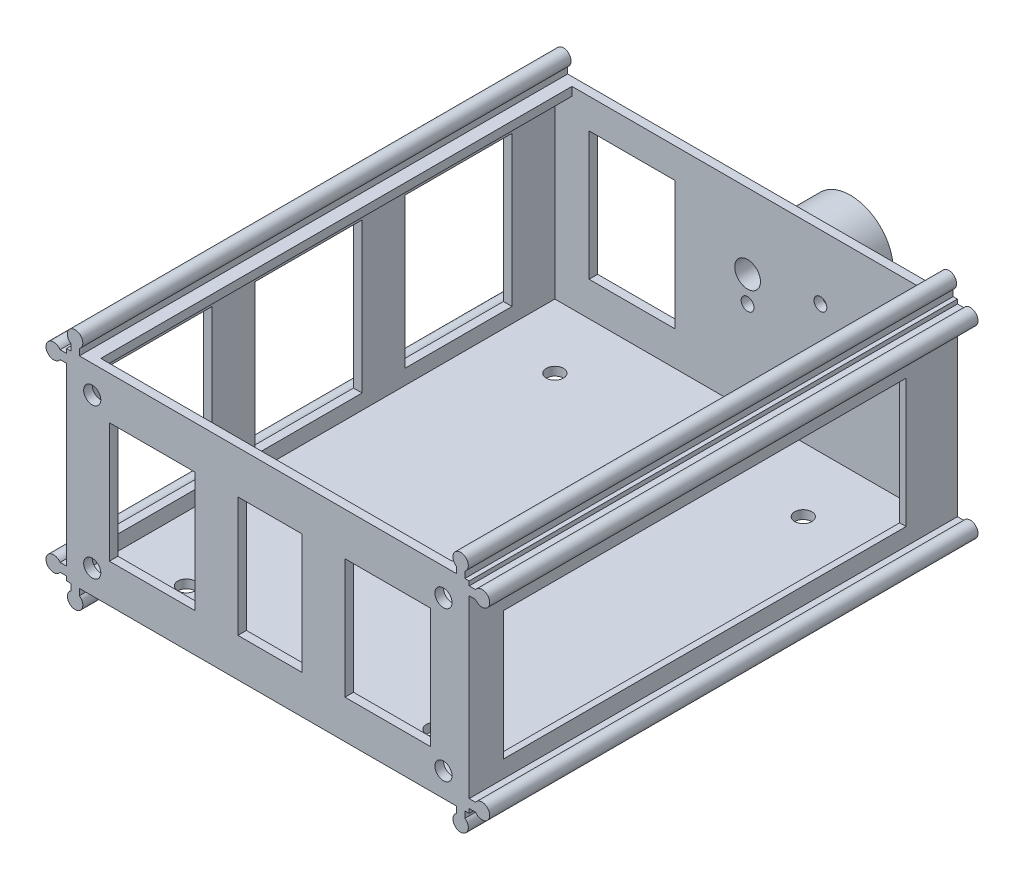
from build123d import *

# Parameters (mm, degrees)
SKETCH_1_W               = 100
SKETCH_1_H               = 130
SKETCH_1_R               = 2
EXTRUDE_1_DEPTH          = 2
SKETCH_3_W               = 100
SKETCH_3_H               = 2
EXTRUDE_2_DEPTH          = 45
SKETCH_4_W               = 1.5
SKETCH_4_H               = 110
EXTRUDE_3_DEPTH          = 5
SKETCH_5_W               = 114
SKETCH_5_H               = 47
EXTRUDE_7_DEPTH          = 2
CUT_EXTRUDE_3_DEPTH      = 171.073513517
CUT_EXTRUDE_3_DEPTH_BACK = 171.073513517
EXTRUDE_10_DEPTH         = 1.5
EXTRUDE_11_DEPTH         = 114
CUT_EXTRUDE_4_REACH      = 160.267
SKETCH_13_R              = 2
SKETCH_14_R              = 10
EXTRUDE_12_DEPTH         = 22
CUT_EXTRUDE_5_REACH      = 160.267
SKETCH_15_R              = 1.5
CUT_EXTRUDE_6_REACH      = 176.781
SKETCH_16_R              = 1.5
CUT_EXTRUDE_7_REACH      = 184.153
SKETCH_17_W              = 25
SKETCH_17_H              = 35
CUT_EXTRUDE_8_REACH      = 160.267
SKETCH_18_W              = 20
SKETCH_18_H              = 30
CUT_EXTRUDE_9_REACH      = 176.781
SKETCH_19_W              = 20
SKETCH_19_H              = 28
SKETCH_19_W_2            = 15
CUT_EXTRUDE_10_REACH     = 176.781
SKETCH_20_R              = 3


with BuildPart() as part:
    # 草图1 → 凸台-拉伸1 (new body)
    with BuildSketch(Plane(origin=(0, 0, 0), x_dir=(1, 0, 0), z_dir=(0, 1, 0))):
        with Locations((50, 65)):
            Rectangle(SKETCH_1_W, SKETCH_1_H)
        with Locations(Location((15, 105, 0), (0, 0, 270))):
            Circle(SKETCH_1_R, mode=Mode.SUBTRACT)
        with Locations(Location((15, 19, 0), (0, 0, 270))):
            Circle(SKETCH_1_R, mode=Mode.SUBTRACT)
        with Locations(Location((73, 105, 0), (0, 0, 270))):
            Circle(SKETCH_1_R, mode=Mode.SUBTRACT)
        with Locations(Location((73, 19, 0), (0, 0, 270))):
            Circle(SKETCH_1_R, mode=Mode.SUBTRACT)
    extrude(amount=EXTRUDE_1_DEPTH)

    # 草图3 → 凸台-拉伸2 (add)
    with BuildSketch(Plane(origin=(0, 2, 0), x_dir=(1, 0, 0), z_dir=(0, 1, 0))):
        with Locations((50, 121)):
            Rectangle(SKETCH_3_W, SKETCH_3_H)
        with Locations((50, 9)):
            Rectangle(SKETCH_3_W, SKETCH_3_H)
    extrude(amount=EXTRUDE_2_DEPTH)

    # 草图4 → 凸台-拉伸3 (add)
    with BuildSketch(Plane(origin=(0, 2, 0), x_dir=(1, 0, 0), z_dir=(0, 1, 0))):
        with Locations((91.25, 65)):
            Rectangle(SKETCH_4_W, SKETCH_4_H)
    extrude(amount=EXTRUDE_3_DEPTH)

    # 草图5 → 凸台-拉伸7 (add)
    with BuildSketch(Plane.ZY):
        with Locations((-65, 23.5)):
            Rectangle(SKETCH_5_W, SKETCH_5_H)
    extrude(amount=EXTRUDE_7_DEPTH)

    # 草图6 → 切除-拉伸3 (cut, two sides: drawn at the far end of the back side and taken through both)
    with BuildSketch(Plane(origin=(0, 2, 0), x_dir=(1, 0, 0), z_dir=(0, 1, 0)).offset(-CUT_EXTRUDE_3_DEPTH_BACK)):
        Polygon((0, 8), (92, 8), (92, 122), (0, 122), (0, 130), (100, 130), (100, 117), (100, 13), (100, 0), (0, 0), align=None)
    extrude(amount=CUT_EXTRUDE_3_DEPTH + CUT_EXTRUDE_3_DEPTH_BACK, mode=Mode.SUBTRACT)

    # 草图11 → 凸台-拉伸10 (add)
    with BuildSketch(Plane(origin=(92, 0, 0), x_dir=(0, 0, -1), z_dir=(1, 0, 0))):
        Polygon((8, 47), (122, 47), (122, 42), (122, 0), (110, 0), (110, 37), (16, 37), (16, 0), (8, 0), align=None)
    extrude(amount=-EXTRUDE_10_DEPTH)

    # 草图12 → 凸台-拉伸11 (add, through all)
    with BuildSketch(Plane.XY.offset(-8)):
        with BuildLine():
            Line((91, 47), (91, 48.5))
            ThreePointArc((91, 48.5), (90, 51.796662955), (89, 48.5))
            Line((89, 48.5), (89, 47))
            Line((89, 47), (86, 47))
            Line((86, 47), (86, 45))
            Line((86, 45), (90, 45))
            Line((90, 45), (90, 42.318790087))
            Line((90, 42.318790087), (92, 42.318790087))
            Line((92, 42.318790087), (92, 44))
            Line((92, 44), (93.5, 44))
            ThreePointArc((93.5, 44), (96.796662955, 45), (93.5, 46))
            Line((93.5, 46), (92, 46))
            Line((92, 46), (92, 47))
            Line((92, 47), (91, 47))
        make_face()
        with BuildLine():
            Line((0, 42.318790087), (0, 45))
            Line((0, 45), (4, 45))
            Line((4, 45), (4, 47))
            Line((4, 47), (1, 47))
            Line((1, 47), (1, 48.5))
            ThreePointArc((1, 48.5), (0, 51.796662955), (-1, 48.5))
            Line((-1, 48.5), (-1, 47))
            Line((-1, 47), (-2, 47))
            Line((-2, 47), (-2, 46))
            Line((-2, 46), (-3.5, 46))
            ThreePointArc((-3.5, 46), (-6.796662955, 45), (-3.5, 44))
            Line((-3.5, 44), (-2, 44))
            Line((-2, 44), (-2, 42.318790087))
            Line((-2, 42.318790087), (0, 42.318790087))
        make_face()
        with BuildLine():
            Line((-1, 0), (-1, -1.5))
            ThreePointArc((-1, -1.5), (0, -4.796662955), (1, -1.5))
            Line((1, -1.5), (1, 0))
            Line((1, 0), (4, 0))
            Line((4, 0), (4, 2))
            Line((4, 2), (0, 2))
            Line((0, 2), (0, 4.681209913))
            Line((0, 4.681209913), (-2, 4.681209913))
            Line((-2, 4.681209913), (-2, 3))
            Line((-2, 3), (-3.5, 3))
            ThreePointArc((-3.5, 3), (-6.796662955, 2), (-3.5, 1))
            Line((-3.5, 1), (-2, 1))
            Line((-2, 1), (-2, 0))
            Line((-2, 0), (-1, 0))
        make_face()
        with BuildLine():
            Line((90, 4.681209913), (90, 2))
            Line((90, 2), (86, 2))
            Line((86, 2), (86, 0))
            Line((86, 0), (89, 0))
            Line((89, 0), (89, -1.5))
            ThreePointArc((89, -1.5), (90, -4.796662955), (91, -1.5))
            Line((91, -1.5), (91, 0))
            Line((91, 0), (92, 0))
            Line((92, 0), (92, 1))
            Line((92, 1), (93.5, 1))
            ThreePointArc((93.5, 1), (96.796662955, 2), (93.5, 3))
            Line((93.5, 3), (92, 3))
            Line((92, 3), (92, 4.681209913))
            Line((92, 4.681209913), (90, 4.681209913))
        make_face()
    extrude(amount=-EXTRUDE_11_DEPTH)

    # 草图13 → 切除-拉伸4 (cut, up to next)
    with BuildSketch(Plane.XY.offset(-8), mode=Mode.PRIVATE) as cut_extrude_4_sk1:
        with Locations((86, 40.599475321)):
            Circle(SKETCH_13_R)
    cut_extrude_4_tool1 = extrude(cut_extrude_4_sk1.sketch, amount=-CUT_EXTRUDE_4_REACH, mode=Mode.PRIVATE) & part.part
    # 草图13 → 切除-拉伸4 (cut, up to next)
    with BuildSketch(Plane.XY.offset(-8), mode=Mode.PRIVATE) as cut_extrude_4_sk2:
        with Locations((86, 5.599475321)):
            Circle(SKETCH_13_R)
    cut_extrude_4_tool2 = extrude(cut_extrude_4_sk2.sketch, amount=-CUT_EXTRUDE_4_REACH, mode=Mode.PRIVATE) & part.part
    # 草图13 → 切除-拉伸4 (cut, up to next)
    with BuildSketch(Plane.XY.offset(-8), mode=Mode.PRIVATE) as cut_extrude_4_sk3:
        with Locations((4, 5.599475321)):
            Circle(SKETCH_13_R)
    cut_extrude_4_tool3 = extrude(cut_extrude_4_sk3.sketch, amount=-CUT_EXTRUDE_4_REACH, mode=Mode.PRIVATE) & part.part
    # 草图13 → 切除-拉伸4 (cut, up to next)
    with BuildSketch(Plane.XY.offset(-8), mode=Mode.PRIVATE) as cut_extrude_4_sk4:
        with Locations((4, 40.599475321)):
            Circle(SKETCH_13_R)
    cut_extrude_4_tool4 = extrude(cut_extrude_4_sk4.sketch, amount=-CUT_EXTRUDE_4_REACH, mode=Mode.PRIVATE) & part.part
    add(cut_extrude_4_tool1.solids().sort_by_distance((86, 40.599475, -8))[0], mode=Mode.SUBTRACT)
    add(cut_extrude_4_tool2.solids().sort_by_distance((86, 5.599475, -8))[0], mode=Mode.SUBTRACT)
    add(cut_extrude_4_tool3.solids().sort_by_distance((4, 5.599475, -8))[0], mode=Mode.SUBTRACT)
    add(cut_extrude_4_tool4.solids().sort_by_distance((4, 40.599475, -8))[0], mode=Mode.SUBTRACT)

    # 草图14 → 凸台-拉伸12 (add)
    with BuildSketch(Plane(origin=(0, 0, -122), x_dir=(-1, 0, 0), z_dir=(0, 0, -1))):
        with Locations(Location((-45, 23.5, 0), (0, 0, 180))):
            Circle(SKETCH_14_R)
    extrude(amount=EXTRUDE_12_DEPTH)

    # 草图15 → 切除-拉伸5 (cut, up to next)
    with BuildSketch(Plane(origin=(0, 0, -122), x_dir=(-1, 0, 0), z_dir=(0, 0, -1)), mode=Mode.PRIVATE) as cut_extrude_5_sk1:
        with Locations((-62, 32)):
            Circle(SKETCH_15_R)
    cut_extrude_5_tool1 = extrude(cut_extrude_5_sk1.sketch, amount=-CUT_EXTRUDE_5_REACH, mode=Mode.PRIVATE) & part.part
    # 草图15 → 切除-拉伸5 (cut, up to next)
    with BuildSketch(Plane(origin=(0, 0, -122), x_dir=(-1, 0, 0), z_dir=(0, 0, -1)), mode=Mode.PRIVATE) as cut_extrude_5_sk2:
        with Locations((-62, 15)):
            Circle(SKETCH_15_R)
    cut_extrude_5_tool2 = extrude(cut_extrude_5_sk2.sketch, amount=-CUT_EXTRUDE_5_REACH, mode=Mode.PRIVATE) & part.part
    add(cut_extrude_5_tool1.solids().sort_by_distance((62, 32, -122))[0], mode=Mode.SUBTRACT)
    add(cut_extrude_5_tool2.solids().sort_by_distance((62, 15, -122))[0], mode=Mode.SUBTRACT)

    # 草图16 → 切除-拉伸6 (cut, up to next)
    with BuildSketch(Plane(origin=(0, 0, -144), x_dir=(-1, 0, 0), z_dir=(0, 0, -1)), mode=Mode.PRIVATE) as cut_extrude_6_sk1:
        with Locations((-45, 23.5)):
            Circle(SKETCH_16_R)
    cut_extrude_6_tool1 = extrude(cut_extrude_6_sk1.sketch, amount=-CUT_EXTRUDE_6_REACH, mode=Mode.PRIVATE) & part.part
    add(cut_extrude_6_tool1.solids().sort_by_distance((45, 23.5, -144))[0], mode=Mode.SUBTRACT)

    # 草图17 → 切除-拉伸7 (cut, up to next)
    with BuildSketch(Plane.ZY.offset(2), mode=Mode.PRIVATE) as cut_extrude_7_sk1:
        with Locations((-97.5, 23)):
            Rectangle(SKETCH_17_W, SKETCH_17_H)
    cut_extrude_7_tool1 = extrude(cut_extrude_7_sk1.sketch, amount=-CUT_EXTRUDE_7_REACH, mode=Mode.PRIVATE) & part.part
    # 草图17 → 切除-拉伸7 (cut, up to next)
    with BuildSketch(Plane.ZY.offset(2), mode=Mode.PRIVATE) as cut_extrude_7_sk2:
        with Locations((-62.5, 23)):
            Rectangle(SKETCH_17_W, SKETCH_17_H)
    cut_extrude_7_tool2 = extrude(cut_extrude_7_sk2.sketch, amount=-CUT_EXTRUDE_7_REACH, mode=Mode.PRIVATE) & part.part
    # 草图17 → 切除-拉伸7 (cut, up to next)
    with BuildSketch(Plane.ZY.offset(2), mode=Mode.PRIVATE) as cut_extrude_7_sk3:
        with Locations((-27.5, 23)):
            Rectangle(SKETCH_17_W, SKETCH_17_H)
    cut_extrude_7_tool3 = extrude(cut_extrude_7_sk3.sketch, amount=-CUT_EXTRUDE_7_REACH, mode=Mode.PRIVATE) & part.part
    add(cut_extrude_7_tool1.solids().sort_by_distance((-2, 23, -97.5))[0], mode=Mode.SUBTRACT)
    add(cut_extrude_7_tool2.solids().sort_by_distance((-2, 23, -62.5))[0], mode=Mode.SUBTRACT)
    add(cut_extrude_7_tool3.solids().sort_by_distance((-2, 23, -27.5))[0], mode=Mode.SUBTRACT)

    # 草图18 → 切除-拉伸8 (cut, up to next)
    with BuildSketch(Plane(origin=(0, 0, -122), x_dir=(-1, 0, 0), z_dir=(0, 0, -1)), mode=Mode.PRIVATE) as cut_extrude_8_sk1:
        with Locations((-18, 25)):
            Rectangle(SKETCH_18_W, SKETCH_18_H)
    cut_extrude_8_tool1 = extrude(cut_extrude_8_sk1.sketch, amount=-CUT_EXTRUDE_8_REACH, mode=Mode.PRIVATE) & part.part
    add(cut_extrude_8_tool1.solids().sort_by_distance((18, 25, -122))[0], mode=Mode.SUBTRACT)

    # 草图19 → 切除-拉伸9 (cut, up to next)
    with BuildSketch(Plane.XY.offset(-8), mode=Mode.PRIVATE) as cut_extrude_9_sk1:
        with Locations((18, 23)):
            Rectangle(SKETCH_19_W, SKETCH_19_H)
    cut_extrude_9_tool1 = extrude(cut_extrude_9_sk1.sketch, amount=-CUT_EXTRUDE_9_REACH, mode=Mode.PRIVATE) & part.part
    # 草图19 → 切除-拉伸9 (cut, up to next)
    with BuildSketch(Plane.XY.offset(-8), mode=Mode.PRIVATE) as cut_extrude_9_sk2:
        with Locations((45.5, 23)):
            Rectangle(SKETCH_19_W_2, SKETCH_19_H)
    cut_extrude_9_tool2 = extrude(cut_extrude_9_sk2.sketch, amount=-CUT_EXTRUDE_9_REACH, mode=Mode.PRIVATE) & part.part
    # 草图19 → 切除-拉伸9 (cut, up to next)
    with BuildSketch(Plane.XY.offset(-8), mode=Mode.PRIVATE) as cut_extrude_9_sk3:
        with Locations((73, 23)):
            Rectangle(SKETCH_19_W, SKETCH_19_H)
    cut_extrude_9_tool3 = extrude(cut_extrude_9_sk3.sketch, amount=-CUT_EXTRUDE_9_REACH, mode=Mode.PRIVATE) & part.part
    add(cut_extrude_9_tool1.solids().sort_by_distance((18, 23, -8))[0], mode=Mode.SUBTRACT)
    add(cut_extrude_9_tool2.solids().sort_by_distance((45.5, 23, -8))[0], mode=Mode.SUBTRACT)
    add(cut_extrude_9_tool3.solids().sort_by_distance((73, 23, -8))[0], mode=Mode.SUBTRACT)

    # 草图20 → 切除-拉伸10 (cut, up to next)
    with BuildSketch(Plane(origin=(0, 0, -144), x_dir=(-1, 0, 0), z_dir=(0, 0, -1)), mode=Mode.PRIVATE) as cut_extrude_10_sk1:
        with Locations((-45, 29.5)):
            Circle(SKETCH_20_R)
    cut_extrude_10_tool1 = extrude(cut_extrude_10_sk1.sketch, amount=-CUT_EXTRUDE_10_REACH, mode=Mode.PRIVATE) & part.part
    add(cut_extrude_10_tool1.solids().sort_by_distance((45, 29.5, -144))[0], mode=Mode.SUBTRACT)


solid = part.part
